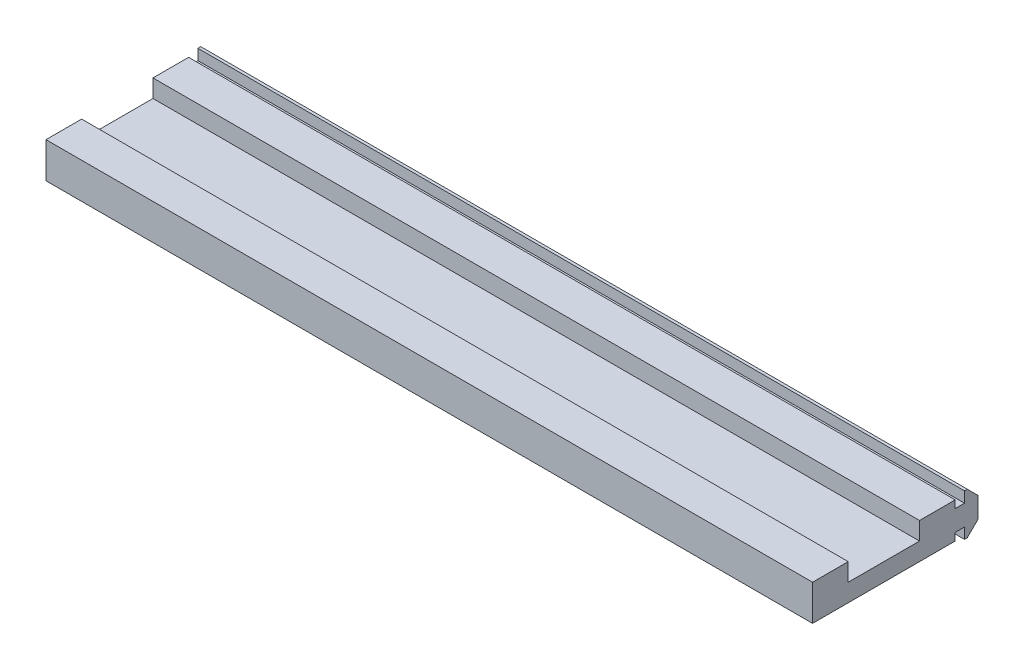
from build123d import *

# Parameters (mm, degrees)
SKETCH1_R           = 2.1
BOSS_EXTRUDE1_DEPTH = 65
SKETCH84_W          = 0.3
SKETCH84_H          = 5.4
BOSS_EXTRUDE6_DEPTH = 430
SKETCH85_W          = 26.589814492
SKETCH85_H          = 26.977421118
CUT_EXTRUDE59_DEPTH = 434.070721707
SKETCH86_W          = 10.5
SKETCH86_H          = 16.670499862
CUT_EXTRUDE60_DEPTH = 20
SKETCH87_W          = 62.679537103
SKETCH87_H          = 29.503453987
CUT_EXTRUDE61_DEPTH = 215
BOSS_EXTRUDE7_DEPTH = 215


with BuildPart() as part:
    # Sketch1 → Boss-Extrude1 (new body)
    with BuildSketch(Plane(origin=(0, 0, 0), x_dir=(0, 0, -1), z_dir=(1, 0, 0))):
        with BuildLine():
            Line((-10, 9), (-10, 3))
            Line((-10, 3), (-8, 3))
            Line((-8, 3), (-8, 6))
            Line((-8, 6), (-7.060660172, 6))
            Line((-7.060660172, 6), (-4, 2.939339828))
            Line((-4, 2.939339828), (-4, -2.939339828))
            Line((-4, -2.939339828), (-7.060660172, -6))
            Line((-7.060660172, -6), (-8, -6))
            Line((-8, -6), (-8, -3))
            Line((-8, -3), (-10, -3))
            Line((-10, -3), (-10, -9))
            ThreePointArc((-10, -9), (-9.707106781, -9.707106781), (-9, -10))
            Line((-9, -10), (-3, -10))
            Line((-3, -10), (-3, -8))
            Line((-3, -8), (-6, -8))
            Line((-6, -8), (-6, -7.060660172))
            Line((-6, -7.060660172), (-2.939339828, -4))
            Line((-2.939339828, -4), (2.939339828, -4))
            Line((2.939339828, -4), (6, -7.060660172))
            Line((6, -7.060660172), (6, -8))
            Line((6, -8), (3, -8))
            Line((3, -8), (3, -10))
            Line((3, -10), (9, -10))
            ThreePointArc((9, -10), (9.707106781, -9.707106781), (10, -9))
            Line((10, -9), (10, -3))
            Line((10, -3), (8, -3))
            Line((8, -3), (8, -6))
            Line((8, -6), (7.060660172, -6))
            Line((7.060660172, -6), (4, -2.939339828))
            Line((4, -2.939339828), (4, 2.939339828))
            Line((4, 2.939339828), (7.060660172, 6))
            Line((7.060660172, 6), (8, 6))
            Line((8, 6), (8, 3))
            Line((8, 3), (10, 3))
            Line((10, 3), (10, 9))
            ThreePointArc((10, 9), (9.707106781, 9.707106781), (9, 10))
            Line((9, 10), (3, 10))
            Line((3, 10), (3, 8))
            Line((3, 8), (6, 8))
            Line((6, 8), (6, 7.060660172))
            Line((6, 7.060660172), (2.939339828, 4))
            Line((2.939339828, 4), (-2.939339828, 4))
            Line((-2.939339828, 4), (-6, 7.060660172))
            Line((-6, 7.060660172), (-6, 8))
            Line((-6, 8), (-3, 8))
            Line((-3, 8), (-3, 10))
            Line((-3, 10), (-9, 10))
            ThreePointArc((-9, 10), (-9.707106781, 9.707106781), (-10, 9))
        make_face()
        Circle(SKETCH1_R, mode=Mode.SUBTRACT)
    extrude(amount=BOSS_EXTRUDE1_DEPTH)

    # Sketch85 → Cut-Extrude59 (cut, through all)
    with BuildSketch(Plane(origin=(65, 0, 0), x_dir=(0, 0, -1), z_dir=(1, 0, 0))):
        with Locations((1.176321583, -0.814927094)):
            Rectangle(SKETCH85_W, SKETCH85_H)
    extrude(amount=-CUT_EXTRUDE59_DEPTH, mode=Mode.SUBTRACT)


with BuildPart() as body_2:
    # Sketch84 → Boss-Extrude6 (new body)
    with BuildSketch(Plane(origin=(65, 0, 0), x_dir=(0, 0, -1), z_dir=(1, 0, 0))):
        Polygon((-10, -2.7), (-10, 2.7), (-10.5, 2.7), (-10.5, 5), (-20.5, 5), (-20.5, 0), (-40.5, 0), (-40.5, 5), (-50.5, 5), (-50.5, -5), (-10.5, -5), (-10.5, -2.7), align=None)
        Polygon((-7.18492424, 5.7), (-4.3, 2.81507576), (-4.3, -2.81507576), (-7.18492424, -5.7), (-7.7, -5.7), (-7.7, -2.7), (-9.7, -2.7), (-9.7, 2.7), (-7.7, 2.7), (-7.7, 5.7), align=None)
        with Locations((-9.85, 0)):
            Rectangle(SKETCH84_W, SKETCH84_H)
    extrude(amount=BOSS_EXTRUDE6_DEPTH)

    # Sketch86 → Cut-Extrude60 (cut)
    with BuildSketch(Plane.ZY.offset(-65)):
        with Locations((5.25, -0.117074477)):
            Rectangle(SKETCH86_W, SKETCH86_H)
    extrude(amount=-CUT_EXTRUDE60_DEPTH, mode=Mode.SUBTRACT)

    # Sketch87 → Cut-Extrude61 (cut)
    with BuildSketch(Plane.ZY.offset(-65)):
        with Locations((27.544038236, 0.275447184)):
            Rectangle(SKETCH87_W, SKETCH87_H)
    extrude(amount=-CUT_EXTRUDE61_DEPTH, mode=Mode.SUBTRACT)

    # Sketch88 → Boss-Extrude7 (add)
    with BuildSketch(Plane.ZY.offset(-280)):
        Polygon((10.7, 2.9), (10.7, -2.9), (7.9, -2.9), (7.9, -5.9), (7.102081528, -5.9), (4.1, -2.897918472), (4.1, 2.897918472), (7.102081528, 5.9), (7.9, 5.9), (7.9, 2.9), align=None)
        Polygon((10.5, 2.7), (10.5, -2.7), (7.7, -2.7), (7.7, -5.7), (7.18492424, -5.7), (4.3, -2.81507576), (4.3, 2.81507576), (7.18492424, 5.7), (7.7, 5.7), (7.7, 2.7), align=None, mode=Mode.SUBTRACT)
    extrude(amount=-BOSS_EXTRUDE7_DEPTH)


solid = body_2.part
